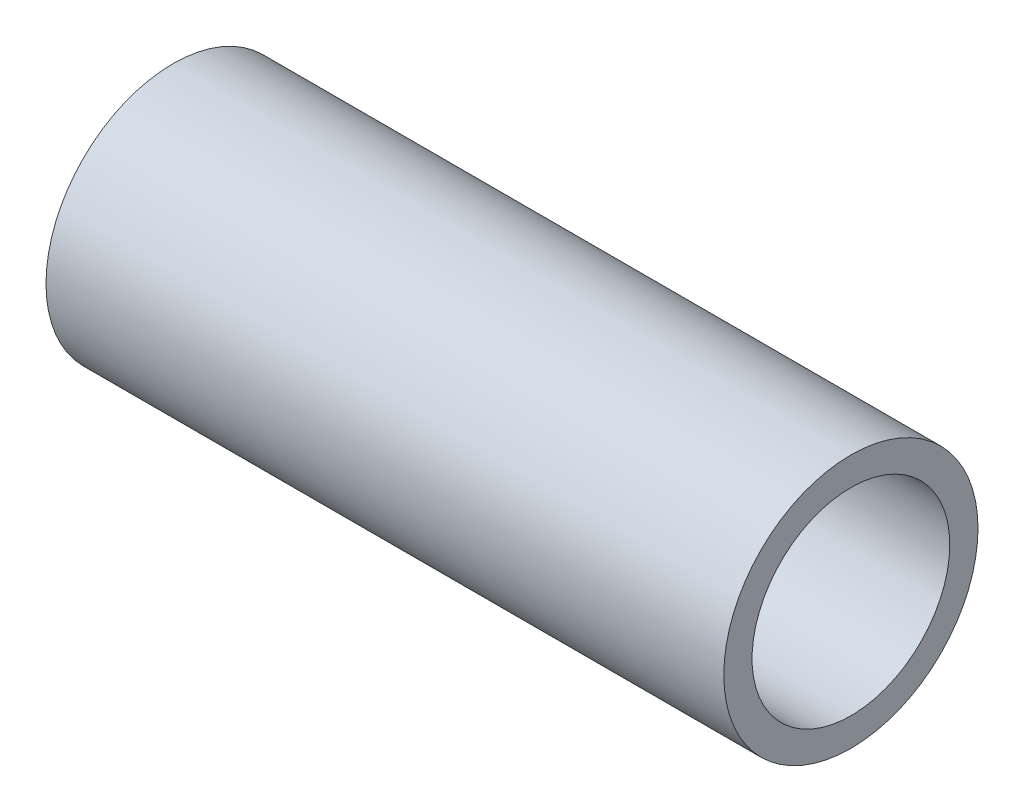
from build123d import *

# Parameters (mm, degrees)
SKETCH1_R           = 9
SKETCH1_R_2         = 7
BOSS_EXTRUDE1_DEPTH = 24


with BuildPart() as part:
    # Sketch1 → Boss-Extrude1 (new, symmetric)
    with BuildSketch(Plane(origin=(0, 0, 0), x_dir=(0, 0, -1), z_dir=(1, 0, 0))):
        Circle(SKETCH1_R)
        Circle(SKETCH1_R_2, mode=Mode.SUBTRACT)
    extrude(amount=BOSS_EXTRUDE1_DEPTH, both=True)


solid = part.part
